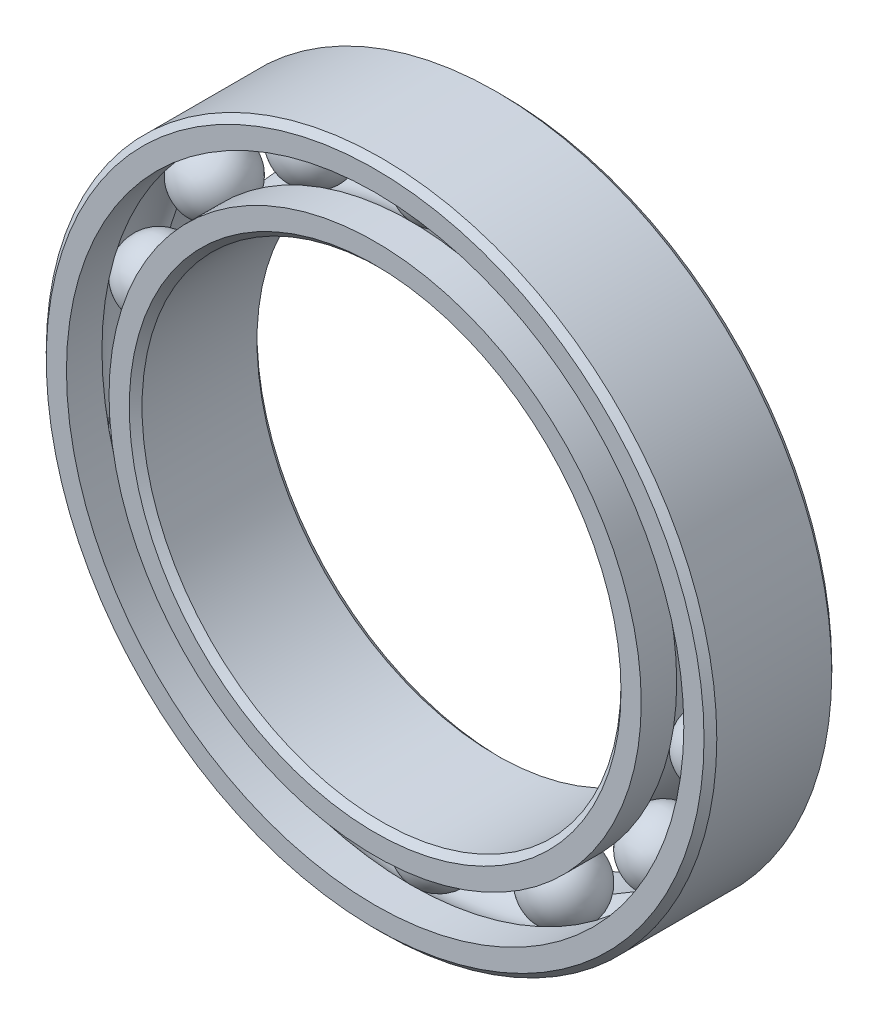
from build123d import *

# Parameters (mm, degrees)
CIRPATTERN1_COUNT = 14


with BuildPart() as part:
    # Sketch5 → Revolve1 (revolve)
    with BuildSketch(Plane(origin=(0, 0, 0), x_dir=(0, 0, -1), z_dir=(1, 0, 0))):
        with BuildLine():
            Line((1.8, 10.5), (-1.8, 10.5))
            Line((-1.8, 10.5), (-2, 10.3))
            Line((-2, 10.3), (-2, 9.666666667))
            Line((-2, 9.666666667), (-0.888888889, 9.666666667))
            ThreePointArc((-0.888888889, 9.666666667), (0, 10.111111111), (0.888888889, 9.666666667))
            Line((0.888888889, 9.666666667), (2, 9.666666667))
            Line((2, 9.666666667), (2, 10.3))
            Line((2, 10.3), (1.8, 10.5))
        make_face()
    revolve(axis=Axis((0, 0, 2), (0, 0, -1)))


with BuildPart() as body_2:
    # Sketch3 → Revolve3 (revolve)
    with BuildSketch(Plane(origin=(0, 0, 0), x_dir=(0, 0, -1), z_dir=(1, 0, 0))):
        with BuildLine():
            Line((-2, 8.333333333), (-0.888888889, 8.333333333))
            ThreePointArc((-0.888888889, 8.333333333), (0, 7.888888889), (0.888888889, 8.333333333))
            Line((0.888888889, 8.333333333), (2, 8.333333333))
            Line((2, 8.333333333), (2, 7.7))
            Line((2, 7.7), (1.8, 7.5))
            Line((1.8, 7.5), (-1.8, 7.5))
            Line((-1.8, 7.5), (-2, 7.7))
            Line((-2, 7.7), (-2, 8.333333333))
        make_face()
    revolve(axis=Axis((0, 0, 2), (0, 0, -1)))


with BuildPart() as body_3:
    # Sketch4 → Revolve4 (revolve)
    with BuildSketch(Plane(origin=(0, 0, 0), x_dir=(0, 0, -1), z_dir=(1, 0, 0))):
        with BuildLine():
            Line((-1.111111111, 9), (1.111111111, 9))
            ThreePointArc((1.111111111, 9), (0, 10.111111111), (-1.111111111, 9))
        make_face()
    revolve(axis=Axis((0, 9, 1.111111111), (0, 0, -1)))


with BuildPart() as cirpattern1_1:
    # CirPattern1: pattern copy
    add(body_3.part.rotate(Axis((0, 0, 0), (0, 0, 1)), 1 * 360 / CIRPATTERN1_COUNT))


with BuildPart() as cirpattern1_2:
    # CirPattern1: pattern copy
    add(body_3.part.rotate(Axis((0, 0, 0), (0, 0, 1)), 2 * 360 / CIRPATTERN1_COUNT))


with BuildPart() as cirpattern1_3:
    # CirPattern1: pattern copy
    add(body_3.part.rotate(Axis((0, 0, 0), (0, 0, 1)), 3 * 360 / CIRPATTERN1_COUNT))


with BuildPart() as cirpattern1_4:
    # CirPattern1: pattern copy
    add(body_3.part.rotate(Axis((0, 0, 0), (0, 0, 1)), 4 * 360 / CIRPATTERN1_COUNT))


with BuildPart() as cirpattern1_5:
    # CirPattern1: pattern copy
    add(body_3.part.rotate(Axis((0, 0, 0), (0, 0, 1)), 5 * 360 / CIRPATTERN1_COUNT))


with BuildPart() as cirpattern1_6:
    # CirPattern1: pattern copy
    add(body_3.part.rotate(Axis((0, 0, 0), (0, 0, 1)), 6 * 360 / CIRPATTERN1_COUNT))


with BuildPart() as cirpattern1_7:
    # CirPattern1: pattern copy
    add(body_3.part.rotate(Axis((0, 0, 0), (0, 0, 1)), 7 * 360 / CIRPATTERN1_COUNT))


with BuildPart() as cirpattern1_8:
    # CirPattern1: pattern copy
    add(body_3.part.rotate(Axis((0, 0, 0), (0, 0, 1)), 8 * 360 / CIRPATTERN1_COUNT))


with BuildPart() as cirpattern1_9:
    # CirPattern1: pattern copy
    add(body_3.part.rotate(Axis((0, 0, 0), (0, 0, 1)), 9 * 360 / CIRPATTERN1_COUNT))


with BuildPart() as cirpattern1_10:
    # CirPattern1: pattern copy
    add(body_3.part.rotate(Axis((0, 0, 0), (0, 0, 1)), 10 * 360 / CIRPATTERN1_COUNT))


with BuildPart() as cirpattern1_11:
    # CirPattern1: pattern copy
    add(body_3.part.rotate(Axis((0, 0, 0), (0, 0, 1)), 11 * 360 / CIRPATTERN1_COUNT))


with BuildPart() as cirpattern1_12:
    # CirPattern1: pattern copy
    add(body_3.part.rotate(Axis((0, 0, 0), (0, 0, 1)), 12 * 360 / CIRPATTERN1_COUNT))


with BuildPart() as cirpattern1_13:
    # CirPattern1: pattern copy
    add(body_3.part.rotate(Axis((0, 0, 0), (0, 0, 1)), 13 * 360 / CIRPATTERN1_COUNT))


solid = Compound([part.part, body_2.part, body_3.part, cirpattern1_1.part, cirpattern1_2.part, cirpattern1_3.part, cirpattern1_4.part, cirpattern1_5.part, cirpattern1_6.part, cirpattern1_7.part, cirpattern1_8.part, cirpattern1_9.part, cirpattern1_10.part, cirpattern1_11.part, cirpattern1_12.part, cirpattern1_13.part])
